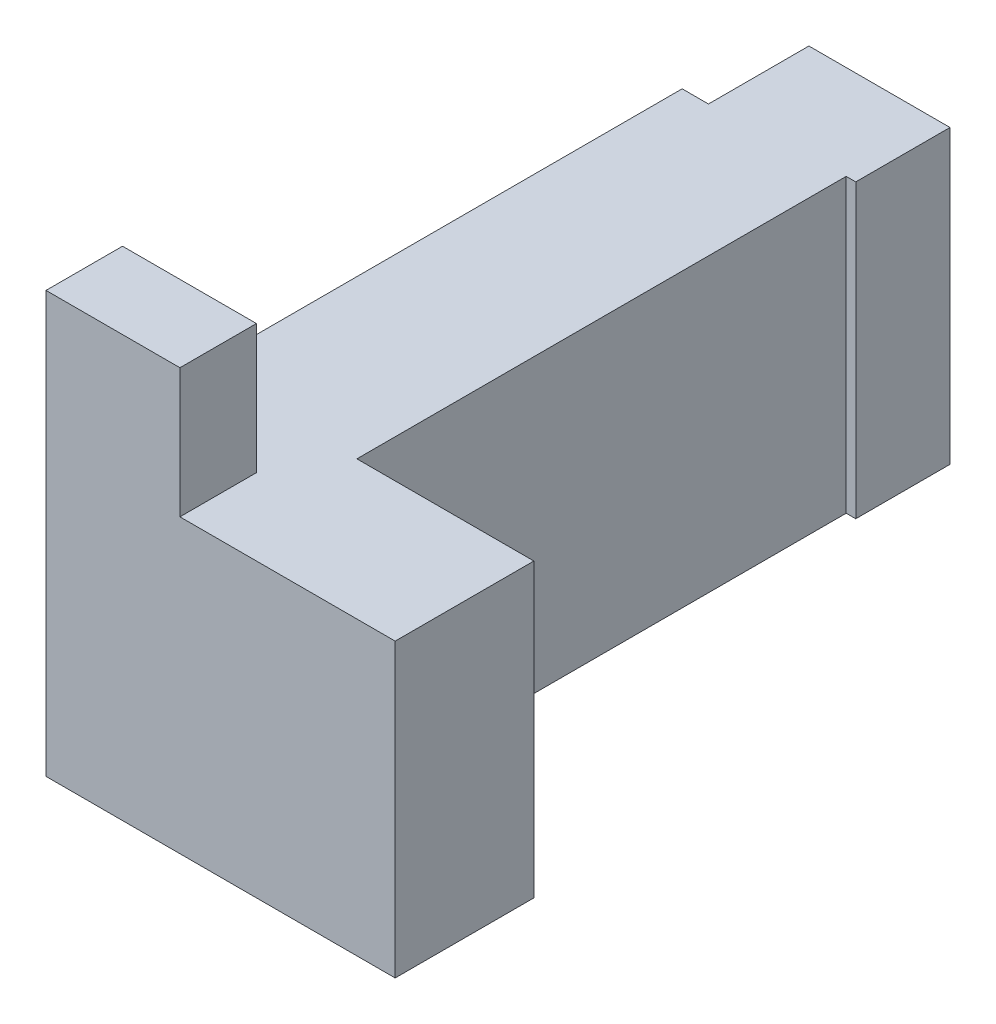
from build123d import *

# Parameters (mm, degrees)
BOSS_EXTRUDE1_DEPTH = 610
SKETCH2_W           = 280
SKETCH2_H           = 160
BOSS_EXTRUDE2_DEPTH = 270


with BuildPart() as part:
    # Sketch1 → Boss-Extrude1 (new body)
    with BuildSketch(Plane(origin=(0, 0, 0), x_dir=(1, 0, 0), z_dir=(0, 1, 0))):
        Polygon((730, 290), (360, 290), (360, 1312.957638722), (380, 1312.957638722), (380, 1510), (85, 1510), (85, 1300), (30, 1300), (30, 320), (0, 320), (0, 0), (730, 0), align=None)
    extrude(amount=BOSS_EXTRUDE1_DEPTH)

    # Sketch2 → Boss-Extrude2 (add)
    with BuildSketch(Plane(origin=(0, 610, 0), x_dir=(1, 0, 0), z_dir=(0, 1, 0))):
        with Locations((140, 80)):
            Rectangle(SKETCH2_W, SKETCH2_H)
    extrude(amount=BOSS_EXTRUDE2_DEPTH)


solid = part.part
